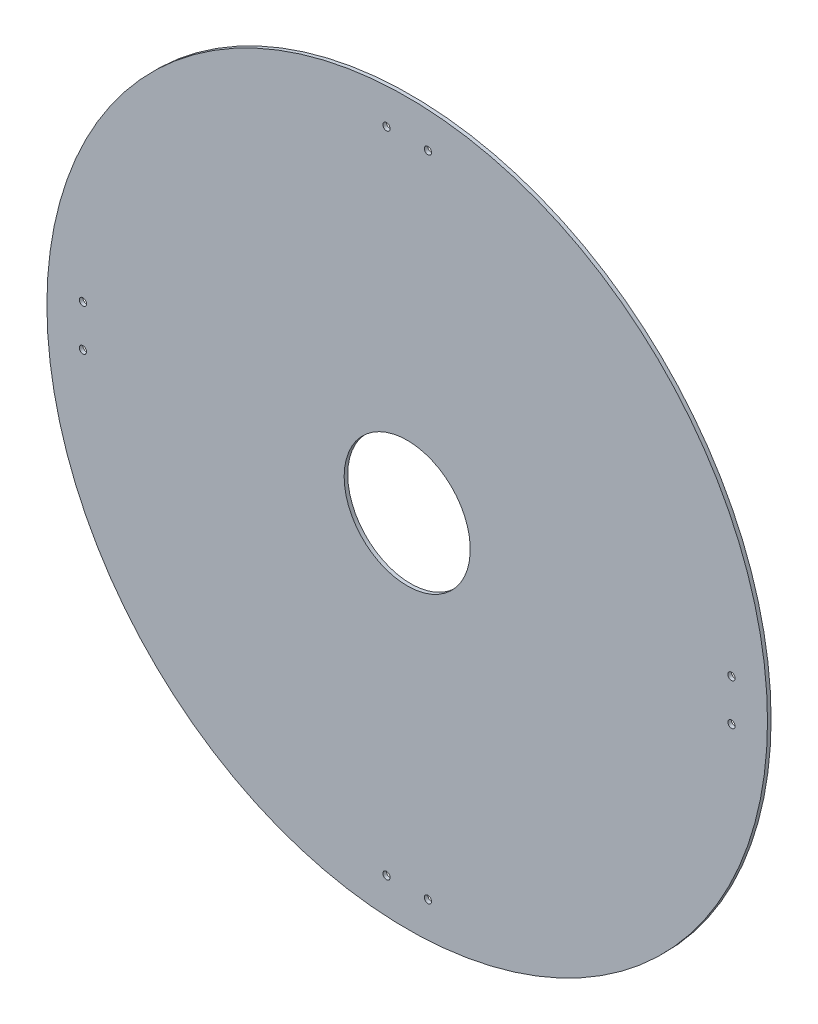
from build123d import *

# Parameters (mm, degrees)
SKETCH1_R           = 200
BOSS_EXTRUDE1_DEPTH = 2
SKETCH2_R           = 2
CUT_EXTRUDE1_DEPTH  = 13
CIRPATTERN1_COUNT   = 4
SKETCH4_R           = 35
CUT_EXTRUDE3_DEPTH  = 283.849783454


with BuildPart() as part:
    # Sketch1 → Boss-Extrude1 (new body)
    with BuildSketch(Plane.XY):
        Circle(SKETCH1_R)
    extrude(amount=BOSS_EXTRUDE1_DEPTH)

    # Sketch2 → Cut-Extrude1 (cut)
    with BuildSketch(Plane(origin=(0, 0, 0), x_dir=(-1, 0, 0), z_dir=(0, 0, -1))):
        with Locations((11.5, 180)):
            Circle(SKETCH2_R)
        with Locations(Location((-11.5, 180, 0), (0, 0, 180))):
            Circle(SKETCH2_R)
    cut_extrude1 = extrude(amount=-CUT_EXTRUDE1_DEPTH, mode=Mode.SUBTRACT)

    # CirPattern1: Cut-Extrude1 ×4 about axis
    cirpattern1_axis = Axis((0, 0, 0), (0, 0, 1))
    for i in range(1, CIRPATTERN1_COUNT):
        add(cut_extrude1.rotate(cirpattern1_axis, i * 360 / CIRPATTERN1_COUNT), mode=Mode.SUBTRACT)

    # Sketch4 → Cut-Extrude3 (cut, through all)
    with BuildSketch(Plane(origin=(0, 0, 0), x_dir=(-1, 0, 0), z_dir=(0, 0, -1))):
        Circle(SKETCH4_R)
    extrude(amount=-CUT_EXTRUDE3_DEPTH, mode=Mode.SUBTRACT)


solid = part.part
